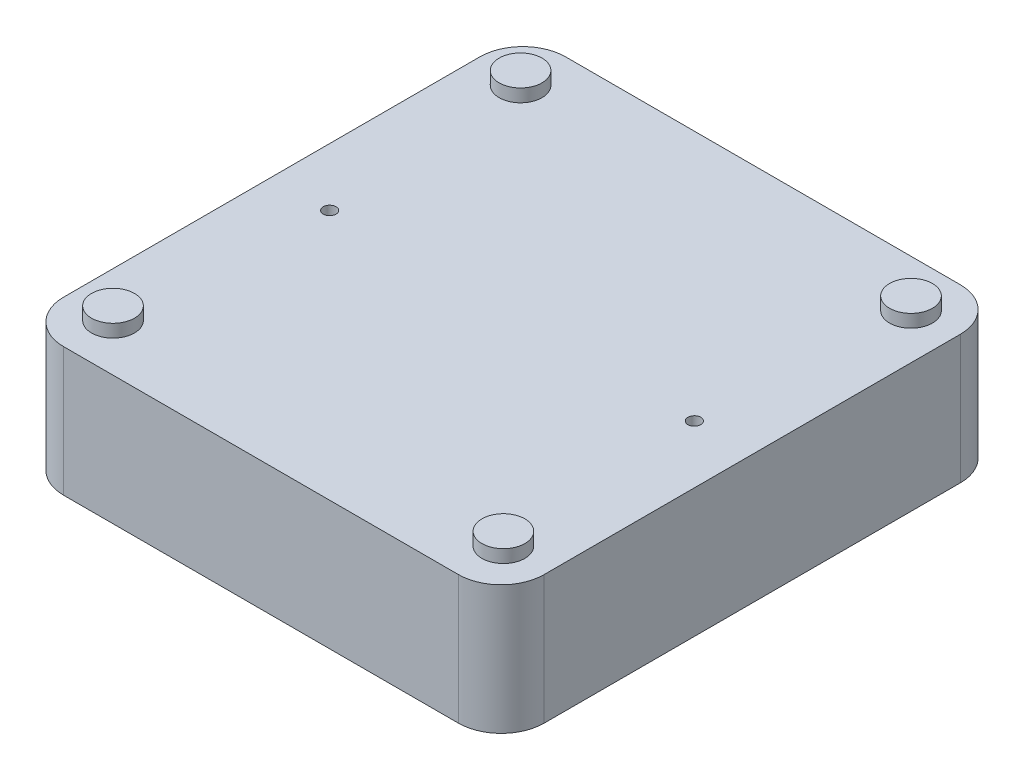
from build123d import *

# Parameters (mm, degrees)
SKETCH_1_W          = 112
SKETCH_1_H          = 117
EXTRUDE_1_DEPTH     = 30
FILLET_1_R          = 10
SKETCH_2_R          = 5
EXTRUDE_2_DEPTH     = 3
SKETCH_3_R          = 1.5
CUT_EXTRUDE_1_DEPTH = 5


with BuildPart() as part:
    # 草图1 → 凸台-拉伸1 (new body)
    with BuildSketch(Plane(origin=(0, 0, 0), x_dir=(1, 0, 0), z_dir=(0, 1, 0))):
        Rectangle(SKETCH_1_W, SKETCH_1_H)
    extrude(amount=EXTRUDE_1_DEPTH)

    # 圆角1
    fillet_1_edges = [part.edges().sort_by_distance(p)[0] for p in [
        (56, 15, 58.5),
        (-56, 15, 58.5),
        (-56, 15, -58.5),
        (56, 15, -58.5),
    ]]
    fillet(fillet_1_edges, radius=FILLET_1_R)

    # 草图2 → 凸台-拉伸2 (add)
    with BuildSketch(Plane(origin=(0, 30, 0), x_dir=(1, 0, 0), z_dir=(0, 1, 0))):
        with Locations(Location((-45.5, 47.5, 0), (0, 0, 90))):
            Circle(SKETCH_2_R)
        with Locations(Location((45.5, 47.5, 0), (0, 0, 90))):
            Circle(SKETCH_2_R)
        with Locations(Location((-45.5, -47.5, 0), (0, 0, 90))):
            Circle(SKETCH_2_R)
        with Locations(Location((45.5, -47.5, 0), (0, 0, 90))):
            Circle(SKETCH_2_R)
    extrude(amount=EXTRUDE_2_DEPTH)

    # 草图3 → 切除-拉伸1 (cut)
    with BuildSketch(Plane(origin=(0, 30, 0), x_dir=(1, 0, 0), z_dir=(0, 1, 0))):
        with Locations(Location((-42.5, 0, 0), (0, 0, 270))):
            Circle(SKETCH_3_R)
        with Locations(Location((42.5, 0, 0), (0, 0, 270))):
            Circle(SKETCH_3_R)
    extrude(amount=-CUT_EXTRUDE_1_DEPTH, mode=Mode.SUBTRACT)


solid = part.part
